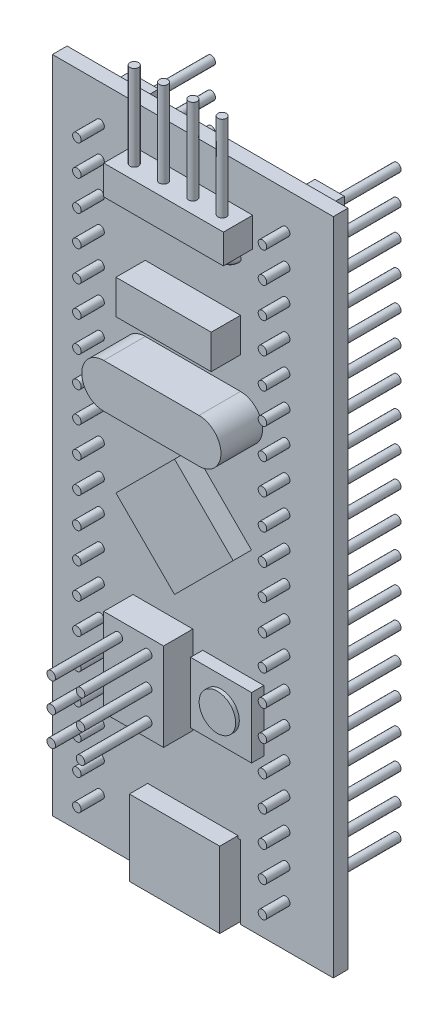
from build123d import *

# Parameters (mm, degrees)
SKETCH_1_W          = 23
SKETCH_1_H          = 54
EXTRUDE_1_DEPTH     = 1.2
SKETCH_2_W          = 2.4
SKETCH_2_H          = 50.6
EXTRUDE_2_DEPTH     = 2.4
SKETCH_3_R          = 0.35
EXTRUDE_3_DEPTH     = 5.5
SKETCH_4_W          = 9.8
SKETCH_4_H          = 2.4
SKETCH_4_W_2        = 4.9
SKETCH_4_H_2        = 7.2
SKETCH_4_W_3        = 7.8
SKETCH_4_H_3        = 2.8
EXTRUDE_4_DEPTH     = 2.4
SKETCH_5_R          = 0.35
EXTRUDE_5_DEPTH     = 7
SKETCH_6_R          = 0.35
SKETCH_7_R          = 0.35
EXTRUDE_6_DEPTH     = 5.5
SKETCH_8_W          = 7.4
SKETCH_8_H          = 6.2
EXTRUDE_7_DEPTH     = 1.5
EXTRUDE_8_DEPTH     = 3.4
SKETCH_10_W         = 5
SKETCH_10_H         = 5
EXTRUDE_9_DEPTH     = 1
SKETCH_11_R         = 1.495071924
EXTRUDE_10_DEPTH    = 0.3
CUT_EXTRUDE_1_DEPTH = 6


with BuildPart() as part:
    # Эскиз1 → Бобышка-Вытянуть1 (new body)
    with BuildSketch(Plane.XY):
        with Locations((0.400091461, -3.870786517)):
            Rectangle(SKETCH_1_W, SKETCH_1_H)
    extrude(amount=EXTRUDE_1_DEPTH)

    # Эскиз2 → Бобышка-Вытянуть2 (add)
    with BuildSketch(Plane(origin=(0, 0, 0), x_dir=(-1, 0, 0), z_dir=(0, 0, -1))):
        with Locations((-8.000091461, -3.870786517)):
            Rectangle(SKETCH_2_W, SKETCH_2_H)
        with Locations((7.199908539, -3.870786517)):
            Rectangle(SKETCH_2_W, SKETCH_2_H)
    extrude(amount=EXTRUDE_2_DEPTH)

    # Эскиз3 → Бобышка-Вытянуть3 (add, symmetric)
    with BuildSketch(Plane(origin=(0, 0, -2.4), x_dir=(-1, 0, 0), z_dir=(0, 0, -1))):
        with Locations((-8.000091461, 20.132856753)):
            Circle(SKETCH_3_R)
        with Locations((7.199908539, 20.132856753)):
            Circle(SKETCH_3_R)
        with Locations((7.199908539, 17.632856753)):
            Circle(SKETCH_3_R)
        with Locations((7.199908539, 15.132856753)):
            Circle(SKETCH_3_R)
        with Locations((7.199908539, 12.632856753)):
            Circle(SKETCH_3_R)
        with Locations((7.199908539, 10.132856753)):
            Circle(SKETCH_3_R)
        with Locations((7.199908539, 7.632856753)):
            Circle(SKETCH_3_R)
        with Locations((7.199908539, 5.132856753)):
            Circle(SKETCH_3_R)
        with Locations((7.199908539, 2.632856753)):
            Circle(SKETCH_3_R)
        with Locations((7.199908539, 0.132856753)):
            Circle(SKETCH_3_R)
        with Locations((7.199908539, -2.367143247)):
            Circle(SKETCH_3_R)
        with Locations((7.199908539, -4.867143247)):
            Circle(SKETCH_3_R)
        with Locations((7.199908539, -7.367143247)):
            Circle(SKETCH_3_R)
        with Locations((7.199908539, -9.867143247)):
            Circle(SKETCH_3_R)
        with Locations((7.199908539, -12.367143247)):
            Circle(SKETCH_3_R)
        with Locations((7.199908539, -14.867143247)):
            Circle(SKETCH_3_R)
        with Locations((7.199908539, -17.367143247)):
            Circle(SKETCH_3_R)
        with Locations((7.199908539, -19.867143247)):
            Circle(SKETCH_3_R)
        with Locations((7.199908539, -22.367143247)):
            Circle(SKETCH_3_R)
        with Locations((7.199908539, -24.867143247)):
            Circle(SKETCH_3_R)
        with Locations((7.199908539, -27.367143247)):
            Circle(SKETCH_3_R)
        with Locations((-8.000091461, 17.632856753)):
            Circle(SKETCH_3_R)
        with Locations((-8.000091461, 15.132856753)):
            Circle(SKETCH_3_R)
        with Locations((-8.000091461, 12.632856753)):
            Circle(SKETCH_3_R)
        with Locations((-8.000091461, 10.132856753)):
            Circle(SKETCH_3_R)
        with Locations((-8.000091461, 7.632856753)):
            Circle(SKETCH_3_R)
        with Locations((-8.000091461, 5.132856753)):
            Circle(SKETCH_3_R)
        with Locations((-8.000091461, 2.632856753)):
            Circle(SKETCH_3_R)
        with Locations((-8.000091461, 0.132856753)):
            Circle(SKETCH_3_R)
        with Locations((-8.000091461, -2.367143247)):
            Circle(SKETCH_3_R)
        with Locations((-8.000091461, -4.867143247)):
            Circle(SKETCH_3_R)
        with Locations((-8.000091461, -7.367143247)):
            Circle(SKETCH_3_R)
        with Locations((-8.000091461, -9.867143247)):
            Circle(SKETCH_3_R)
        with Locations((-8.000091461, -12.367143247)):
            Circle(SKETCH_3_R)
        with Locations((-8.000091461, -14.867143247)):
            Circle(SKETCH_3_R)
        with Locations((-8.000091461, -17.367143247)):
            Circle(SKETCH_3_R)
        with Locations((-8.000091461, -19.867143247)):
            Circle(SKETCH_3_R)
        with Locations((-8.000091461, -22.367143247)):
            Circle(SKETCH_3_R)
        with Locations((-8.000091461, -24.867143247)):
            Circle(SKETCH_3_R)
        with Locations((-8.000091461, -27.367143247)):
            Circle(SKETCH_3_R)
    extrude(amount=EXTRUDE_3_DEPTH, both=True)

    # Эскиз4 → Бобышка-Вытянуть4 (add)
    with BuildSketch(Plane.XY.offset(1.2)):
        with Locations((0.400091461, 18.729213483)):
            Rectangle(SKETCH_4_W, SKETCH_4_H)
        with Locations((-2.049908539, -15.470786517)):
            Rectangle(SKETCH_4_W_2, SKETCH_4_H_2)
        with Locations((0.400091461, 10.929213483)):
            Rectangle(SKETCH_4_W_3, SKETCH_4_H_3)
    extrude(amount=EXTRUDE_4_DEPTH)

    # Эскиз5 → Бобышка-Вытянуть5 (add)
    with BuildSketch(Plane(origin=(0, 19.929213483, 0), x_dir=(1, 0, 0), z_dir=(0, 1, 0))):
        with Locations((-3.199908539, -2.4)):
            Circle(SKETCH_5_R)
        with Locations((-0.799908539, -2.4)):
            Circle(SKETCH_5_R)
        with Locations((1.600091461, -2.4)):
            Circle(SKETCH_5_R)
        with Locations((4.000091461, -2.4)):
            Circle(SKETCH_5_R)
    extrude(amount=EXTRUDE_5_DEPTH)

    # Эскиз6 → Повернуть1 (revolve)
    with BuildSketch(Plane.XZ.offset(-17.529213483), mode=Mode.PRIVATE) as revolve_1_sk:
        with Locations((-3.199908539, 2.4)):
            Circle(SKETCH_6_R)
        with Locations((-0.799908539, 2.4)):
            Circle(SKETCH_6_R)
        with Locations((1.600091461, 2.4)):
            Circle(SKETCH_6_R)
        with Locations((4.000091461, 2.4)):
            Circle(SKETCH_6_R)
    revolve(revolve_1_sk.sketch.rotate(Axis((-4.499908539, 17.529213483, 1.2), (1, 0, 0)), 45), axis=Axis((-4.499908539, 17.529213483, 1.2), (1, 0, 0)))

    # Эскиз7 → Бобышка-Вытянуть6 (add, symmetric)
    with BuildSketch(Plane.XY.offset(3.6)):
        with Locations((-3.299908539, -13.070786517)):
            Circle(SKETCH_7_R)
        with Locations((-0.899908539, -13.070786517)):
            Circle(SKETCH_7_R)
        with Locations((-0.899908539, -15.470786517)):
            Circle(SKETCH_7_R)
        with Locations((-0.899908539, -17.870786517)):
            Circle(SKETCH_7_R)
        with Locations((-3.299908539, -15.470786517)):
            Circle(SKETCH_7_R)
        with Locations((-3.299908539, -17.870786517)):
            Circle(SKETCH_7_R)
    extrude(amount=EXTRUDE_6_DEPTH, both=True)

    # Эскиз8 → Бобышка-Вытянуть7 (add)
    with BuildSketch(Plane.XY.offset(1.2)):
        Polygon((-4.399908539, -3.870786517), (0.400091461, 0.929213483), (5.200091461, -3.870786517), (0.400091461, -8.670786517), align=None)
        with Locations((0.400091461, -27.770786517)):
            Rectangle(SKETCH_8_W, SKETCH_8_H)
    extrude(amount=EXTRUDE_7_DEPTH)

    # Эскиз9 → Бобышка-Вытянуть8 (add)
    with BuildSketch(Plane.XY.offset(1.2)):
        with BuildLine():
            Line((-3.499908539, 6.929213483), (4.300091461, 6.929213483))
            ThreePointArc((4.300091461, 6.929213483), (6.100091461, 5.129213483), (4.300091461, 3.329213483))
            Line((4.300091461, 3.329213483), (-3.499908539, 3.329213483))
            ThreePointArc((-3.499908539, 3.329213483), (-5.299908539, 5.129213483), (-3.499908539, 6.929213483))
        make_face()
    extrude(amount=EXTRUDE_8_DEPTH)

    # Эскиз10 → Бобышка-Вытянуть9 (add)
    with BuildSketch(Plane.XY.offset(1.2)):
        with Locations((3.709299321, -15.470786517)):
            Rectangle(SKETCH_10_W, SKETCH_10_H)
    extrude(amount=EXTRUDE_9_DEPTH)

    # Эскиз11 → Бобышка-Вытянуть10 (add)
    with BuildSketch(Plane.XY.offset(2.2)):
        with Locations((3.709299321, -15.470786517)):
            Circle(SKETCH_11_R)
    extrude(amount=EXTRUDE_10_DEPTH)

    # Эскиз12 → Вырез-Вытянуть1 (cut)
    with BuildSketch(Plane.XZ.offset(30.870786517)):
        Polygon((-3.48398033, 1.2), (-3.48398033, 0), (4.284163251, 0), (4.284163251, 1.2), (4.100091461, 1.2), (4.100091461, 0.727005887), (3.520830502, 0.185516694), (-2.720647581, 0.185516694), (-3.299908539, 0.727005887), (-3.299908539, 1.2), align=None)
    extrude(amount=-CUT_EXTRUDE_1_DEPTH, mode=Mode.SUBTRACT)


solid = part.part
